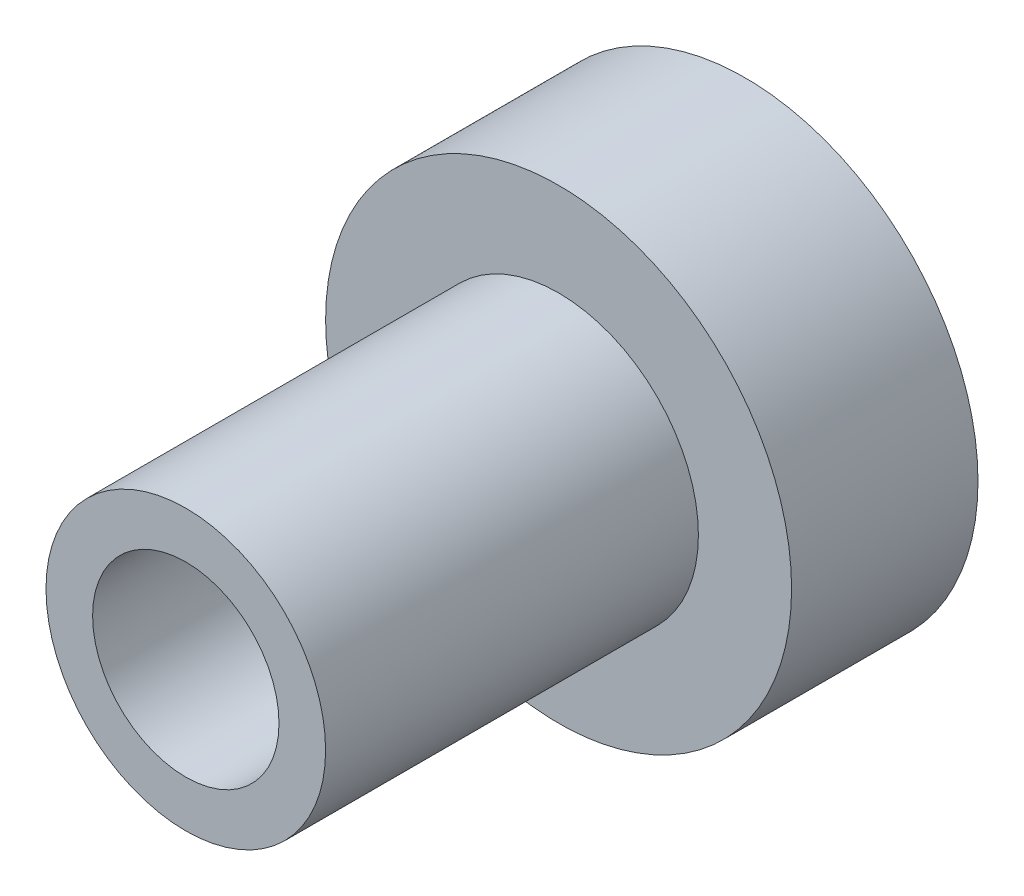
from build123d import *

# Parameters (mm, degrees)
CROQUIS1_R                   = 25
SALIENTE_EXTRUIR1_DEPTH      = 20
SALIENTE_EXTRUIR2_DEPTH      = 40
SALIENTE_EXTRUIR2_DEPTH_BACK = 1
CROQUIS2_R                   = 15
CROQUIS3_R                   = 10
CORTAR_EXTRUIR1_DEPTH        = 40


with BuildPart() as part:
    # Croquis1 → Saliente-Extruir1 (new body)
    with BuildSketch(Plane.XY):
        with Locations(Location((0, 0, 0), (0, 0, 180))):
            Circle(CROQUIS1_R)
    extrude(amount=SALIENTE_EXTRUIR1_DEPTH)

    # Croquis2 → Saliente-Extruir2 (add, two sides: drawn at the far end of the back side and taken through both)
    with BuildSketch(Plane.XY.offset(20).offset(-SALIENTE_EXTRUIR2_DEPTH_BACK)):
        Circle(CROQUIS2_R)
    extrude(amount=SALIENTE_EXTRUIR2_DEPTH + SALIENTE_EXTRUIR2_DEPTH_BACK)

    # Croquis3 → Cortar-Extruir1 (cut)
    with BuildSketch(Plane.XY.offset(60)):
        Circle(CROQUIS3_R)
    extrude(amount=-CORTAR_EXTRUIR1_DEPTH, mode=Mode.SUBTRACT)


solid = part.part
